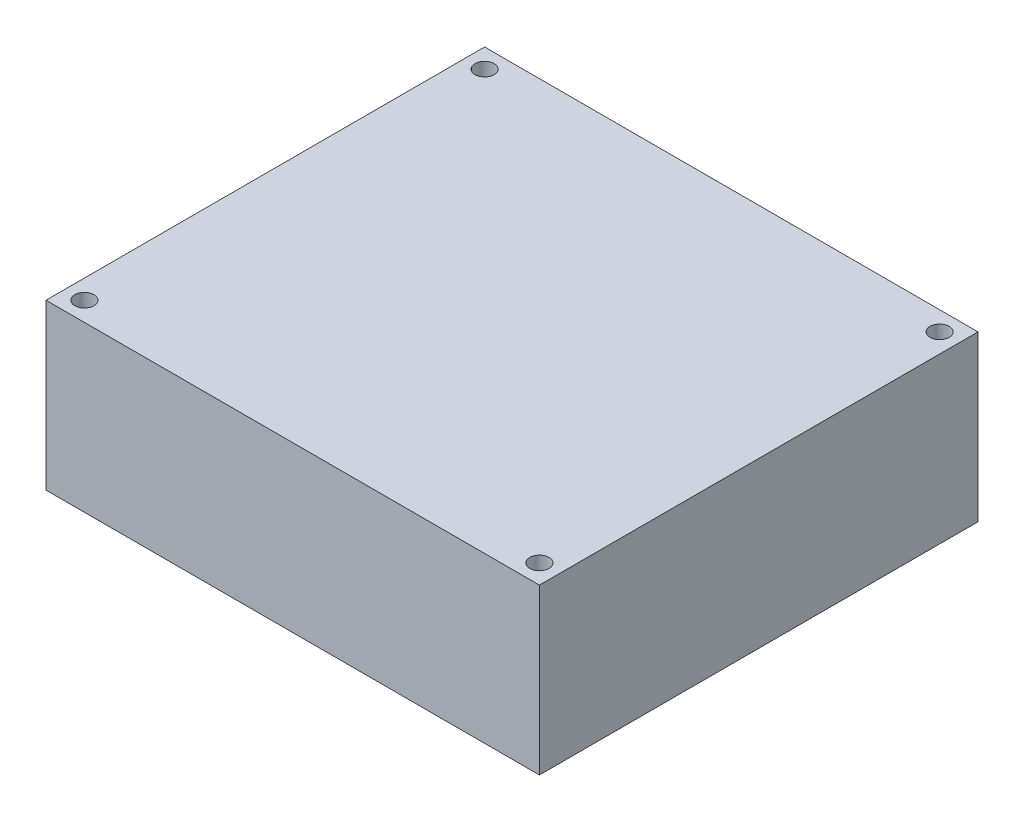
from build123d import *

# Parameters (mm, degrees)
SKETCH_1_W      = 90
SKETCH_1_H      = 80
SKETCH_1_R      = 1.75
EXTRUDE_1_DEPTH = 30


with BuildPart() as part:
    # 草图1 → 凸台-拉伸1 (new body)
    with BuildSketch(Plane(origin=(0, 0, 0), x_dir=(1, 0, 0), z_dir=(0, 1, 0))):
        Rectangle(SKETCH_1_W, SKETCH_1_H)
        with Locations(Location((-41.5, 36.5, 0), (0, 0, 270))):
            Circle(SKETCH_1_R, mode=Mode.SUBTRACT)
        with Locations(Location((41.5, 36.5, 0), (0, 0, 270))):
            Circle(SKETCH_1_R, mode=Mode.SUBTRACT)
        with Locations(Location((41.5, -36.5, 0), (0, 0, 270))):
            Circle(SKETCH_1_R, mode=Mode.SUBTRACT)
        with Locations(Location((-41.5, -36.5, 0), (0, 0, 270))):
            Circle(SKETCH_1_R, mode=Mode.SUBTRACT)
    extrude(amount=EXTRUDE_1_DEPTH)


solid = part.part
